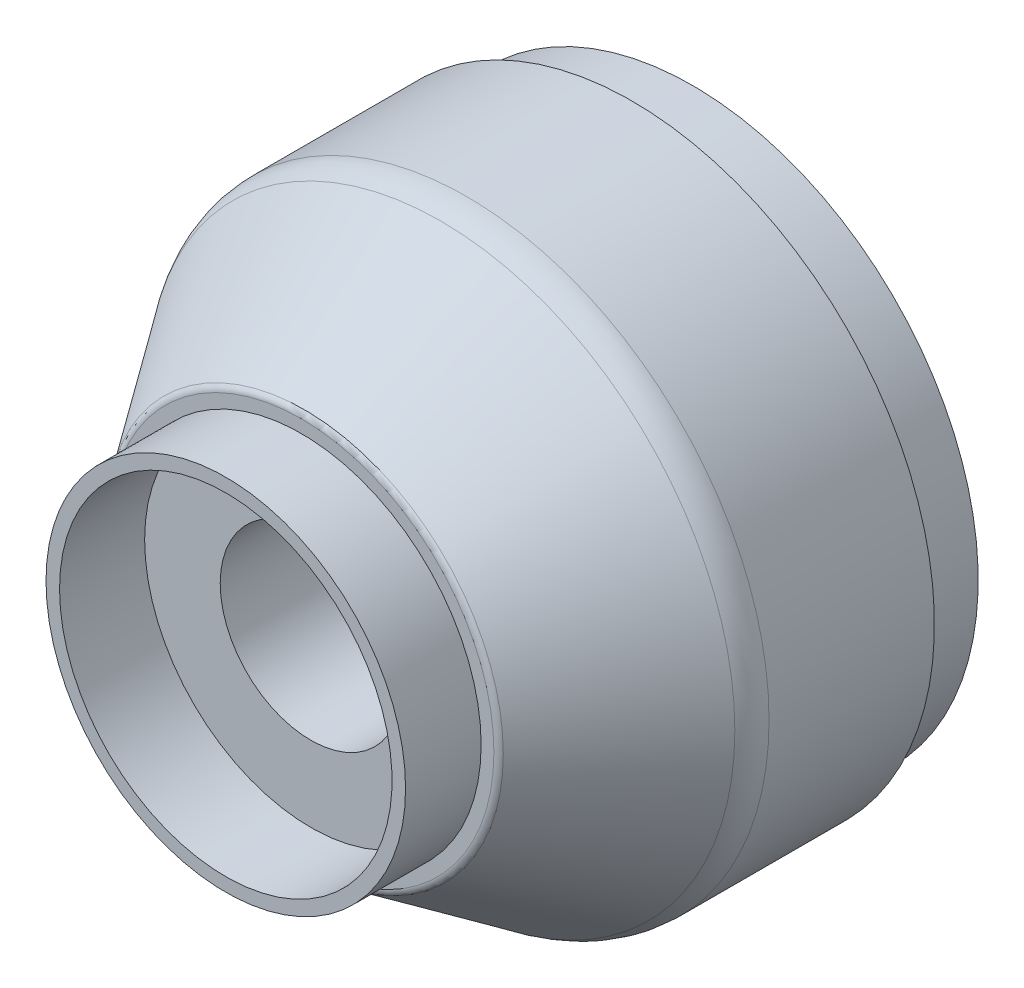
from build123d import *

# Parameters (mm, degrees)
FILLET1_R = 3
FILLET2_R = 0.5


with BuildPart() as part:
    # base-sketch-2 → Revolve1 (revolve)
    with BuildSketch(Plane(origin=(0, 0, 0), x_dir=(1, 0, 0), z_dir=(0, 1, 0)), mode=Mode.PRIVATE) as revolve1_sk:
        Polygon((11, -26), (16.6, -18), (16.25, -18), (6, -18), (6, -26), align=None)
        Polygon((18.8956045, -0.741902481), (18, -0.741902481), (18, -3.95), (18, -16), (16.6, -18), (11, -26), (11, -31.630444462), (11.8956045, -31.630444462), (11.8956045, -26.630444462), (13, -26.630444462), (20, -16.630444462), (20, -4.741902481), (18.8956045, -4.741902481), align=None)
        Polygon((18, -16), (18, -3.95), (16.25, -16), (16.25, -18), (16.6, -18), align=None)
    revolve(revolve1_sk.sketch.rotate(Axis((0, 0, 0), (0, 0, 1)), 180), axis=Axis((0, 0, 0), (0, 0, 1)))

    # Fillet1
    fillet1_edges = [part.edges().sort_by_distance(p)[0] for p in [
        (20, 0, 16.630444462),
    ]]
    fillet(fillet1_edges, radius=FILLET1_R)

    # Fillet2
    fillet2_edges = [part.edges().sort_by_distance(p)[0] for p in [
        (13, 0, 26.630444462),
    ]]
    fillet(fillet2_edges, radius=FILLET2_R)


solid = part.part
